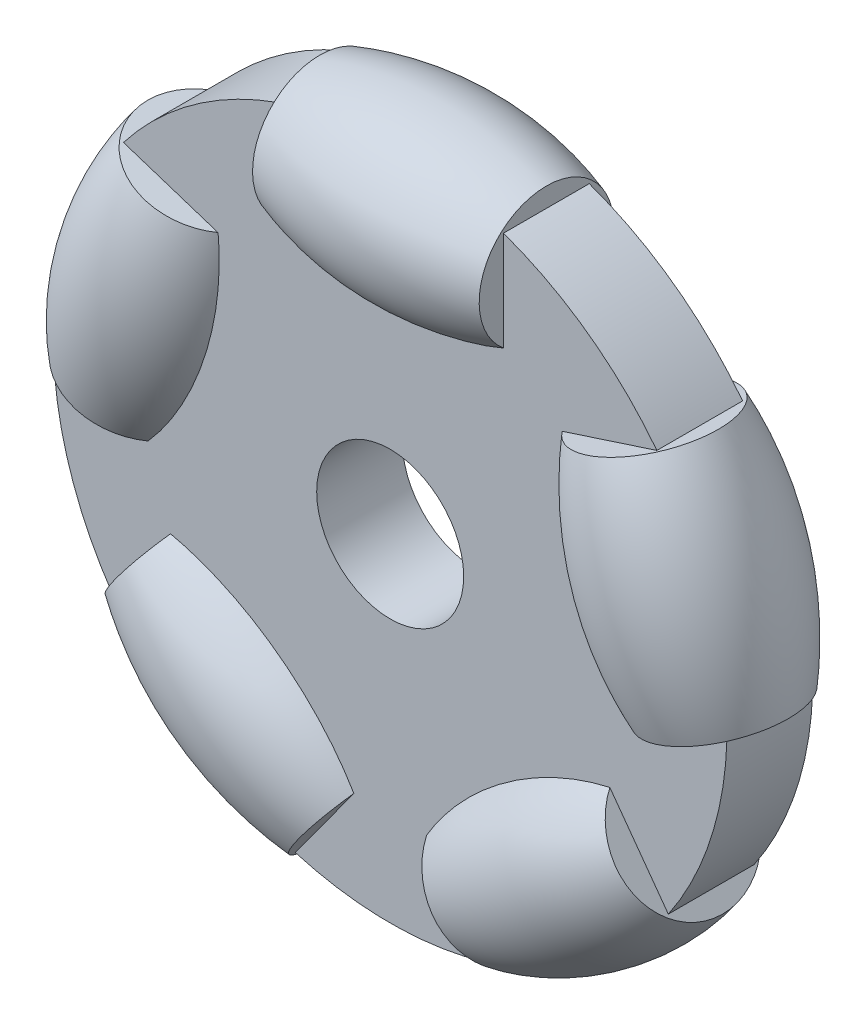
from build123d import *

# Parameters (mm, degrees)
SKETCH1_7_R         = 27.5
BOSS_EXTRUDE1_DEPTH = 3.5
CUT_EXTRUDE8_REACH  = 44.335
SKETCH4_R           = 6


with BuildPart() as part:
    # Sketch1 → Revolve16 (revolve)
    with BuildSketch(Plane.XY):
        with BuildLine():
            Line((-9.25, 22.000000003), (-9.25, 27.485223303))
            ThreePointArc((-9.25, 27.485223303), (0, 29), (9.25, 27.485223303))
            Line((9.25, 27.485223303), (9.25, 22.000000003))
            Line((9.25, 22.000000003), (-9.25, 22.000000003))
        make_face()
    revolve(axis=Axis((-9.25, 22.000000003, 0), (1, 0, 0)))



with BuildPart() as body_2:
    # Sketch1<3> → Revolve17 (revolve)
    with BuildSketch(Plane.XY):
        with BuildLine():
            Line((-18.064836163, 15.595646653), (-23.281593526, 17.29067387))
            ThreePointArc((-23.281593526, 17.29067387), (-27.580638973, 8.961492837), (-28.998407922, -0.303871681))
            Line((-28.998407922, -0.303871681), (-23.781650559, -1.998898899))
            Line((-23.781650559, -1.998898899), (-18.064836163, 15.595646653))
        make_face()
    revolve(axis=Axis((-23.781650559, -1.998898899, 0), (0.3090169943749582, 0.9510565162951501, 0)))


with BuildPart() as body_3:
    # Sketch1<4> → Revolve18 (revolve)
    with BuildSketch(Plane.XY):
        with BuildLine():
            Line((-20.41468275, -12.361360295), (-23.638816111, -16.798999162))
            ThreePointArc((-23.638816111, -16.798999162), (-17.045772316, -23.461492837), (-8.672001715, -27.67302633))
            Line((-8.672001715, -27.67302633), (-5.447868354, -23.235387462))
            Line((-5.447868354, -23.235387462), (-20.41468275, -12.361360295))
        make_face()
    revolve(axis=Axis((-5.447868354, -23.235387462, 0), (-0.8090169943749421, 0.5877852522924805, 0)))


with BuildPart() as body_4:
    # Sketch1<5> → Revolve19 (revolve)
    with BuildSketch(Plane.XY):
        with BuildLine():
            Line((5.447868354, -23.235387462), (8.672001715, -27.67302633))
            ThreePointArc((8.672001715, -27.67302633), (17.045772316, -23.461492837), (23.638816111, -16.798999162))
            Line((23.638816111, -16.798999162), (20.41468275, -12.361360295))
            Line((20.41468275, -12.361360295), (5.447868354, -23.235387462))
        make_face()
    revolve(axis=Axis((20.41468275, -12.361360295, 0), (-0.8090169943749509, -0.5877852522924685, 0)))


with BuildPart() as body_5:
    # Sketch1<6> → Revolve20 (revolve)
    with BuildSketch(Plane.XY):
        with BuildLine():
            Line((23.781650559, -1.998898899), (28.998407922, -0.303871681))
            ThreePointArc((28.998407922, -0.303871681), (27.580638973, 8.961492837), (23.281593526, 17.29067387))
            Line((23.281593526, 17.29067387), (18.064836163, 15.595646653))
            Line((18.064836163, 15.595646653), (23.781650559, -1.998898899))
        make_face()
    revolve(axis=Axis((18.064836163, 15.595646653, 0), (0.30901699437494456, -0.9510565162951546, 0)))


with BuildPart() as part_1:
    add(part.part)

    add(body_2.part)  # Boss-Extrude1 merges body 2

    add(body_3.part)  # Boss-Extrude1 merges body 3

    add(body_4.part)  # Boss-Extrude1 merges body 4

    add(body_5.part)  # Boss-Extrude1 merges body 5
    # Sketch1<7> → Boss-Extrude1 (add, symmetric)
    with BuildSketch(Plane.XY):
        Circle(SKETCH1_7_R)
    extrude(amount=BOSS_EXTRUDE1_DEPTH, both=True)

    # Sketch4 → Cut-Extrude8 (cut, up to next)
    with BuildSketch(Plane(origin=(0, 0, -3.5), x_dir=(-1, 0, 0), z_dir=(0, 0, -1)), mode=Mode.PRIVATE) as cut_extrude8_sk1:
        Circle(SKETCH4_R)
    cut_extrude8_tool1 = extrude(cut_extrude8_sk1.sketch, amount=-CUT_EXTRUDE8_REACH, mode=Mode.PRIVATE) & part_1.part
    add(cut_extrude8_tool1.solids().sort_by_distance((0, 0, -3.5))[0], mode=Mode.SUBTRACT)


solid = part_1.part
